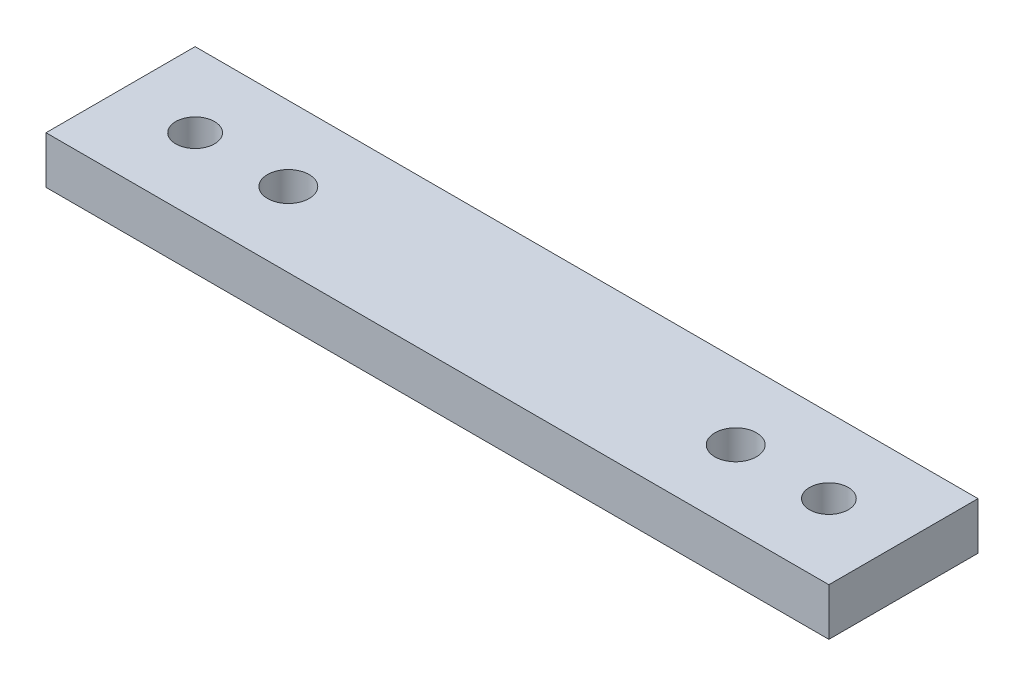
from build123d import *

# Parameters (mm, degrees)
BOSS_EXTRUDE1_DEPTH      = 3.175
BOSS_EXTRUDE1_DEPTH_BACK = 3.175
SKETCH1_W                = 105
SKETCH1_H                = 20
SKETCH1_R                = 2.794
SKETCH1_R_2              = 2.6


with BuildPart() as part:
    # Sketch1 → Boss-Extrude1 (new, two sides: drawn at the far end of the back side and taken through both)
    with BuildSketch(Plane(origin=(0, 0, 0), x_dir=(1, 0, 0), z_dir=(0, 1, 0)).offset(-BOSS_EXTRUDE1_DEPTH_BACK)):
        Rectangle(SKETCH1_W, SKETCH1_H)
        with Locations((-30, 0)):
            Circle(SKETCH1_R, mode=Mode.SUBTRACT)
        with Locations((30, 0)):
            Circle(SKETCH1_R, mode=Mode.SUBTRACT)
        with Locations((-42.5, 0)):
            Circle(SKETCH1_R_2, mode=Mode.SUBTRACT)
        with Locations((42.5, 0)):
            Circle(SKETCH1_R_2, mode=Mode.SUBTRACT)
    extrude(amount=BOSS_EXTRUDE1_DEPTH + BOSS_EXTRUDE1_DEPTH_BACK)


solid = part.part
